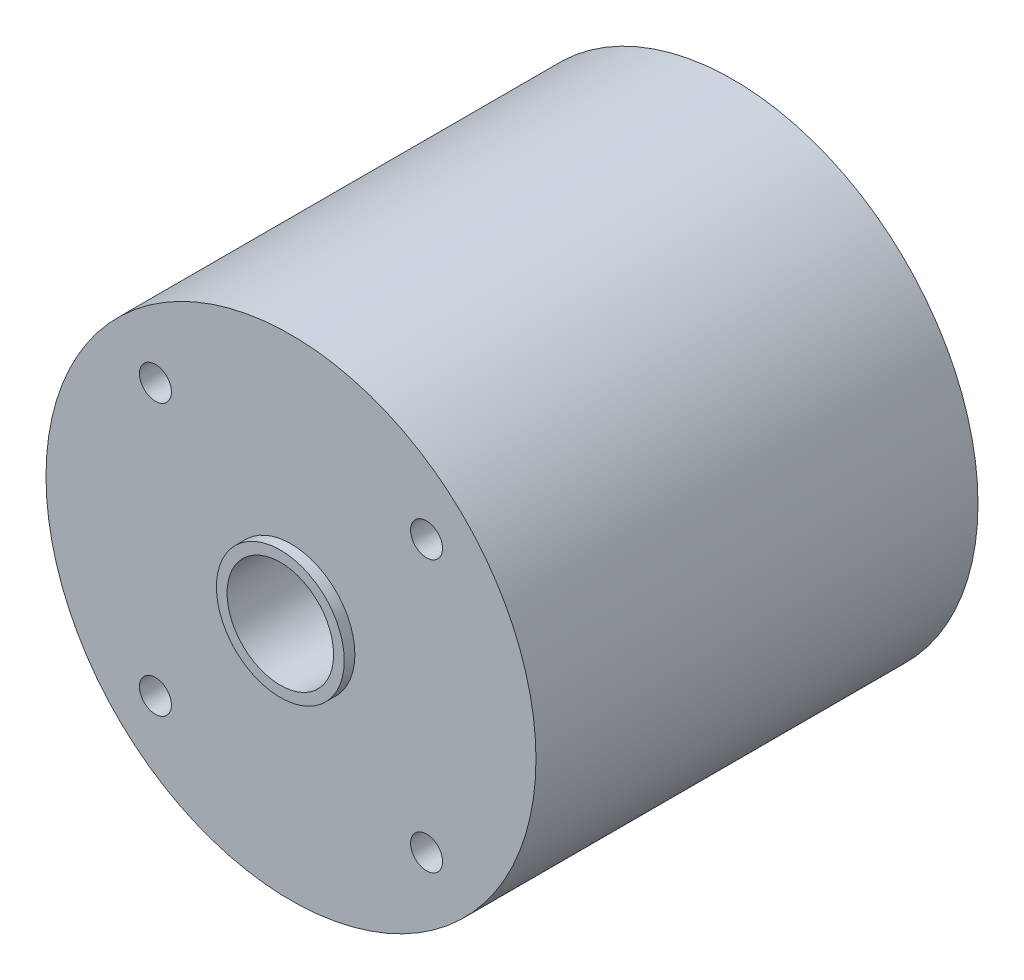
from build123d import *

# Parameters (mm, degrees)
IZIM1_R                     = 46
IZIM1_R_2                   = 12
IZIM1_R_3                   = 10
Y_KSEKLIK_EKSTR_ZYON2_DEPTH = 83
Y_KSEKLIK_EKSTR_ZYON3_START = 2
IZIM1_4_R                   = 12
IZIM1_4_R_2                 = 10
Y_KSEKLIK_EKSTR_ZYON3_DEPTH = 2
Y_KSEKLIK_EKSTR_ZYON4_START = -83
IZIM1_7_R                   = 12
IZIM1_7_R_2                 = 10
Y_KSEKLIK_EKSTR_ZYON4_DEPTH = 2
IZIM2_R                     = 3
KES_EKSTR_ZYON1_DEPTH       = 100


with BuildPart() as part:
    # Çizim1 → Yükseklik-Ekstrüzyon2 (new body)
    # profile 1 of 2: a face of its own
    with BuildSketch(Plane.XY):
        Circle(IZIM1_R)
        Circle(IZIM1_R_2, mode=Mode.SUBTRACT)
    # profile 2 of 2: a face of its own
    with BuildSketch(Plane.XY):
        Circle(IZIM1_R_2)
        Circle(IZIM1_R_3, mode=Mode.SUBTRACT)
    extrude(amount=-Y_KSEKLIK_EKSTR_ZYON2_DEPTH)

    # Çizim1<4> → Yükseklik-Ekstrüzyon3 (add)
    with BuildSketch(Plane.XY.offset(Y_KSEKLIK_EKSTR_ZYON3_START)):
        Circle(IZIM1_4_R)
        Circle(IZIM1_4_R_2, mode=Mode.SUBTRACT)
    extrude(amount=-Y_KSEKLIK_EKSTR_ZYON3_DEPTH)

    # Çizim1<7> → Yükseklik-Ekstrüzyon4 (add)
    with BuildSketch(Plane.XY.offset(Y_KSEKLIK_EKSTR_ZYON4_START)):
        Circle(IZIM1_7_R)
        Circle(IZIM1_7_R_2, mode=Mode.SUBTRACT)
    extrude(amount=-Y_KSEKLIK_EKSTR_ZYON4_DEPTH)

    # Çizim2 → Kes-Ekstrüzyon1 (cut)
    with BuildSketch(Plane.XY):
        with Locations((-25.455844123, 25.455844123)):
            Circle(IZIM2_R)
        with Locations((25.455844123, 25.455844123)):
            Circle(IZIM2_R)
        with Locations((25.455844123, -25.455844123)):
            Circle(IZIM2_R)
        with Locations((-25.455844123, -25.455844123)):
            Circle(IZIM2_R)
    extrude(amount=-KES_EKSTR_ZYON1_DEPTH, mode=Mode.SUBTRACT)


solid = part.part
